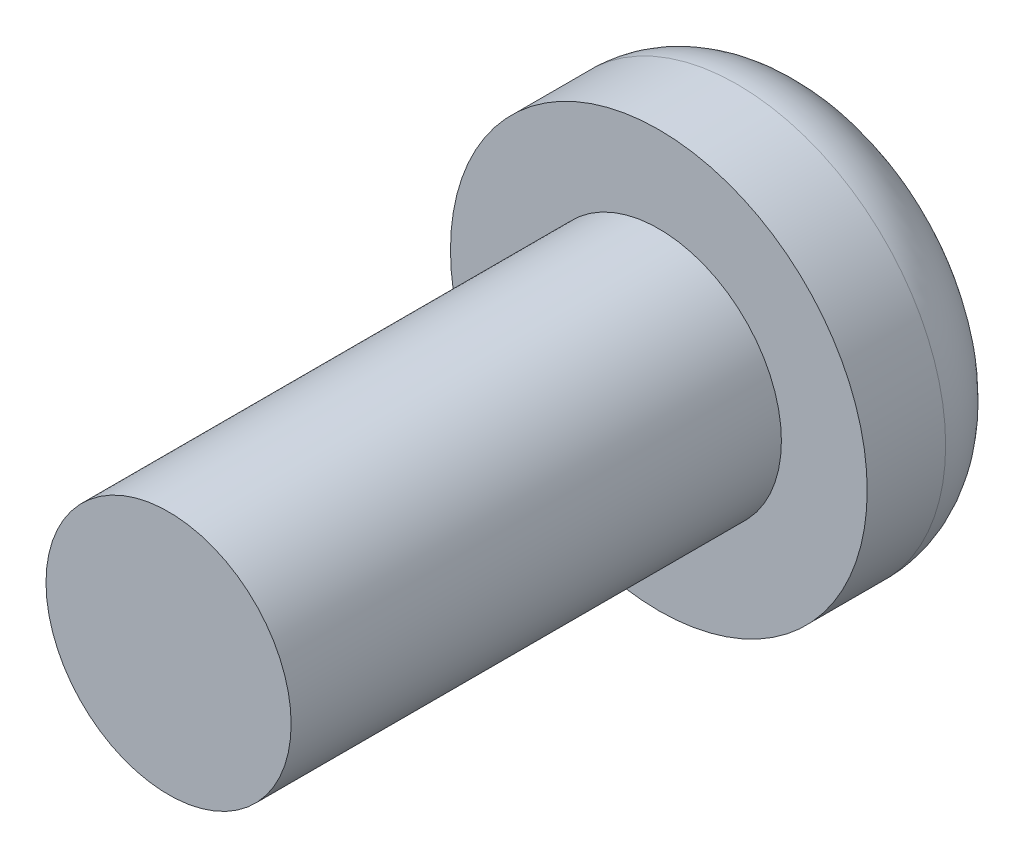
from build123d import *

# Parameters (mm, degrees)
SKETCH1_R           = 4.25
BOSS_EXTRUDE4_DEPTH = 3.2
SKETCH3_W           = 1
SKETCH3_H           = 4
SKETCH3_W_2         = 4
SKETCH3_H_2         = 1
CUT_EXTRUDE1_DEPTH  = 0.5
SKETCH4_R           = 2.5
BOSS_EXTRUDE7_DEPTH = 10


with BuildPart() as part:
    # Sketch1 → Boss-Extrude4 (new body)
    with BuildSketch(Plane.XY):
        Circle(SKETCH1_R)
    extrude(amount=BOSS_EXTRUDE4_DEPTH)

    # Sketch2 → Cut-Revolve1 (revolve, cut)
    with BuildSketch(Plane(origin=(0, 0, 0), x_dir=(1, 0, 0), z_dir=(0, 1, 0))):
        with BuildLine():
            Line((-4.25, -1.6), (-4.25, 0))
            Line((-4.25, 0), (-2.65, 0))
            ThreePointArc((-2.65, 0), (-3.78137085, -0.46862915), (-4.25, -1.6))
        make_face()
    revolve(axis=Axis((0, 0, 0), (0, 0, 1)), mode=Mode.SUBTRACT)

    # Sketch3 → Cut-Extrude1 (cut)
    with BuildSketch(Plane(origin=(0, 0, 0), x_dir=(-1, 0, 0), z_dir=(0, 0, -1))):
        Rectangle(SKETCH3_W, SKETCH3_H)
        Rectangle(SKETCH3_W_2, SKETCH3_H_2)
    extrude(amount=-CUT_EXTRUDE1_DEPTH, mode=Mode.SUBTRACT)

    # Sketch4 → Boss-Extrude7 (add)
    with BuildSketch(Plane.XY.offset(3.2)):
        Circle(SKETCH4_R)
    extrude(amount=BOSS_EXTRUDE7_DEPTH)


solid = part.part
